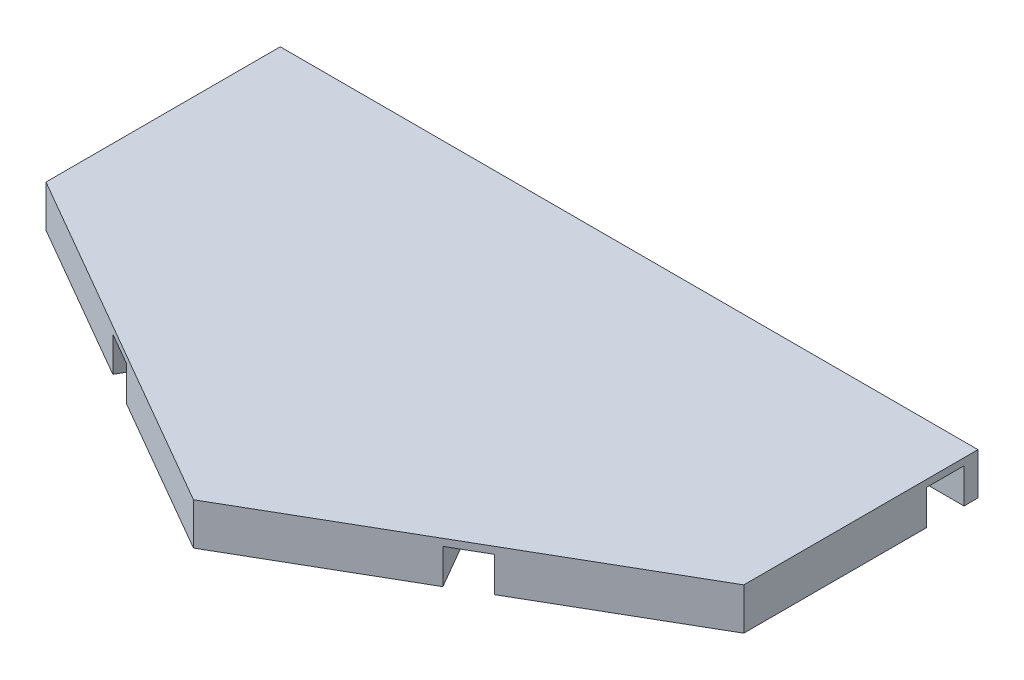
from build123d import *

# Parameters (mm, degrees)
BOSS_EXTRUDE1_DEPTH     = 6
SKETCH2_W               = 100
SKETCH2_H               = 5.4
CUT_EXTRUDE_THIN1_DEPTH = 5
SKETCH3_OUTSIDE_W       = 132.574
SKETCH3_OUTSIDE_H       = 148.044
CUT_EXTRUDE1_DEPTH      = 6


with BuildPart() as part:
    # Sketch1 → Boss-Extrude1 (new body)
    with BuildSketch(Plane(origin=(0, 0, 0), x_dir=(1, 0, 0), z_dir=(0, 1, 0))):
        Polygon((0, 57.735026919), (-50, 28.867513459), (-50, -28.867513459), (0, -57.735026919), (50, -28.867513459), (50, 28.867513459), align=None)
    extrude(amount=BOSS_EXTRUDE1_DEPTH)

    # Sketch2 → Cut-Extrude-Thin1 (cut)
    with BuildSketch(Plane.XZ):
        Polygon((-27.33826859, 41.951270189), (-3.33826859, 0.382050808), (1.33826859, 3.082050808), (-22.66173141, 44.651270189), align=None)
        Rectangle(SKETCH2_W, SKETCH2_H)
        Polygon((22.66173141, 44.651270189), (-1.33826859, 3.082050808), (3.33826859, 0.382050808), (27.33826859, 41.951270189), align=None)
    extrude(amount=-CUT_EXTRUDE_THIN1_DEPTH, mode=Mode.SUBTRACT)

    # Sketch3 outside → Cut-Extrude1 (cut)
    with BuildSketch(Plane.XZ):
        Rectangle(SKETCH3_OUTSIDE_W, SKETCH3_OUTSIDE_H)
        Polygon((-50, 28.867513459), (0, 57.735026919), (50, 28.867513459), (50, -4.7), (-50, -4.7), align=None, mode=Mode.SUBTRACT)
    extrude(amount=-CUT_EXTRUDE1_DEPTH, mode=Mode.SUBTRACT)


solid = part.part
